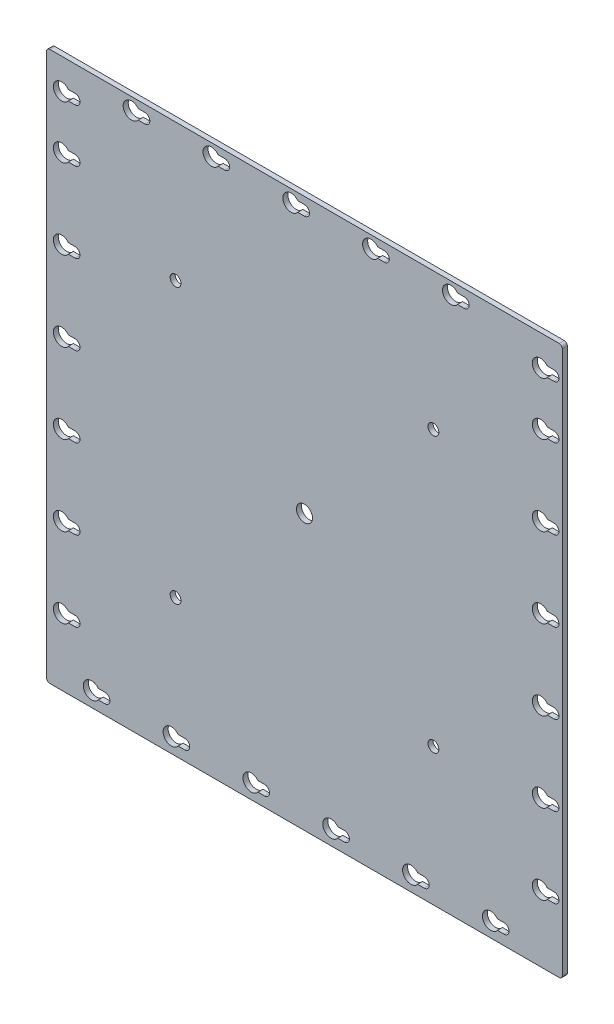
from build123d import *

# Parameters (mm, degrees)
SKETCH1_W               = 164.1
SKETCH1_H               = 174.745
SKETCH1_R               = 2.5527
BOSS_EXTRUDE1_DEPTH     = 1.6
FILLET1_R               = 1
CUT_EXTRUDE1_DEPTH      = 241.065688979
CUT_EXTRUDE1_DEPTH_BACK = 241.065688979
SKETCH2_R               = 1.725


with BuildPart() as part:
    # Sketch1 → Boss-Extrude1 (new body)
    with BuildSketch(Plane.XY):
        with Locations((82.55, -87.3725)):
            Rectangle(SKETCH1_W, SKETCH1_H)
        with Locations((82.55, -87.3725)):
            Circle(SKETCH1_R, mode=Mode.SUBTRACT)
        with BuildLine():
            Line((82.55, -5.4375), (80.434372699, -5.4375))
            ThreePointArc((80.434372699, -5.4375), (75.6625, -3.85), (80.434372699, -2.2625))
            Line((80.434372699, -2.2625), (82.55, -2.2625))
            ThreePointArc((82.55, -2.2625), (84.1375, -3.85), (82.55, -5.4375))
        make_face(mode=Mode.SUBTRACT)
        with BuildLine():
            Line((16.934372699, -168.395), (19.05, -168.395))
            ThreePointArc((19.05, -168.395), (20.6375, -169.9825), (19.05, -171.57))
            Line((19.05, -171.57), (16.934372699, -171.57))
            ThreePointArc((16.934372699, -171.57), (12.1625, -169.9825), (16.934372699, -168.395))
        make_face(mode=Mode.SUBTRACT)
        with BuildLine():
            Line((7.409372699, -151.9325), (9.525, -151.9325))
            ThreePointArc((9.525, -151.9325), (11.1125, -153.52), (9.525, -155.1075))
            Line((9.525, -155.1075), (7.409372699, -155.1075))
            ThreePointArc((7.409372699, -155.1075), (2.6375, -153.52), (7.409372699, -151.9325))
        make_face(mode=Mode.SUBTRACT)
        with BuildLine():
            Line((42.334372699, -168.395), (44.45, -168.395))
            ThreePointArc((44.45, -168.395), (46.0375, -169.9825), (44.45, -171.57))
            Line((44.45, -171.57), (42.334372699, -171.57))
            ThreePointArc((42.334372699, -171.57), (37.5625, -169.9825), (42.334372699, -168.395))
        make_face(mode=Mode.SUBTRACT)
        with BuildLine():
            Line((67.734372699, -168.395), (69.85, -168.395))
            ThreePointArc((69.85, -168.395), (71.4375, -169.9825), (69.85, -171.57))
            Line((69.85, -171.57), (67.734372699, -171.57))
            ThreePointArc((67.734372699, -171.57), (62.9625, -169.9825), (67.734372699, -168.395))
        make_face(mode=Mode.SUBTRACT)
        with BuildLine():
            Line((7.409372699, -126.5325), (9.525, -126.5325))
            ThreePointArc((9.525, -126.5325), (11.1125, -128.12), (9.525, -129.7075))
            Line((9.525, -129.7075), (7.409372699, -129.7075))
            ThreePointArc((7.409372699, -129.7075), (2.6375, -128.12), (7.409372699, -126.5325))
        make_face(mode=Mode.SUBTRACT)
        with BuildLine():
            Line((7.409372699, -101.1325), (9.525, -101.1325))
            ThreePointArc((9.525, -101.1325), (11.1125, -102.72), (9.525, -104.3075))
            Line((9.525, -104.3075), (7.409372699, -104.3075))
            ThreePointArc((7.409372699, -104.3075), (2.6375, -102.72), (7.409372699, -101.1325))
        make_face(mode=Mode.SUBTRACT)
        with BuildLine():
            Line((7.409372699, -75.7325), (9.525, -75.7325))
            ThreePointArc((9.525, -75.7325), (11.1125, -77.32), (9.525, -78.9075))
            Line((9.525, -78.9075), (7.409372699, -78.9075))
            ThreePointArc((7.409372699, -78.9075), (2.6375, -77.32), (7.409372699, -75.7325))
        make_face(mode=Mode.SUBTRACT)
        with BuildLine():
            Line((7.409372699, -50.3325), (9.525, -50.3325))
            ThreePointArc((9.525, -50.3325), (11.1125, -51.92), (9.525, -53.5075))
            Line((9.525, -53.5075), (7.409372699, -53.5075))
            ThreePointArc((7.409372699, -53.5075), (2.6375, -51.92), (7.409372699, -50.3325))
        make_face(mode=Mode.SUBTRACT)
        with BuildLine():
            Line((7.409372699, -24.9325), (9.525, -24.9325))
            ThreePointArc((9.525, -24.9325), (11.1125, -26.52), (9.525, -28.1075))
            Line((9.525, -28.1075), (7.409372699, -28.1075))
            ThreePointArc((7.409372699, -28.1075), (2.6375, -26.52), (7.409372699, -24.9325))
        make_face(mode=Mode.SUBTRACT)
        with BuildLine():
            Line((7.409372699, -8.1), (9.525, -8.1))
            ThreePointArc((9.525, -8.1), (11.1125, -9.6875), (9.525, -11.275))
            Line((9.525, -11.275), (7.409372699, -11.275))
            ThreePointArc((7.409372699, -11.275), (2.6375, -9.6875), (7.409372699, -8.1))
        make_face(mode=Mode.SUBTRACT)
        with BuildLine():
            Line((29.634372699, -2.2625), (31.75, -2.2625))
            ThreePointArc((31.75, -2.2625), (33.3375, -3.85), (31.75, -5.4375))
            Line((31.75, -5.4375), (29.634372699, -5.4375))
            ThreePointArc((29.634372699, -5.4375), (24.8625, -3.85), (29.634372699, -2.2625))
        make_face(mode=Mode.SUBTRACT)
        with BuildLine():
            Line((55.034372699, -2.2625), (57.15, -2.2625))
            ThreePointArc((57.15, -2.2625), (58.7375, -3.85), (57.15, -5.4375))
            Line((57.15, -5.4375), (55.034372699, -5.4375))
            ThreePointArc((55.034372699, -5.4375), (50.2625, -3.85), (55.034372699, -2.2625))
        make_face(mode=Mode.SUBTRACT)
        with BuildLine():
            ThreePointArc((161.925, -8.1), (163.5125, -9.6875), (161.925, -11.275))
            Line((161.925, -11.275), (159.809372699, -11.275))
            ThreePointArc((159.809372699, -11.275), (155.0375, -9.6875), (159.809372699, -8.1))
            Line((159.809372699, -8.1), (161.925, -8.1))
        make_face(mode=Mode.SUBTRACT)
        with BuildLine():
            Line((93.134372699, -168.395), (95.25, -168.395))
            ThreePointArc((95.25, -168.395), (96.8375, -169.9825), (95.25, -171.57))
            Line((95.25, -171.57), (93.134372699, -171.57))
            ThreePointArc((93.134372699, -171.57), (88.3625, -169.9825), (93.134372699, -168.395))
        make_face(mode=Mode.SUBTRACT)
        with BuildLine():
            Line((118.534372699, -168.395), (120.65, -168.395))
            ThreePointArc((120.65, -168.395), (122.2375, -169.9825), (120.65, -171.57))
            Line((120.65, -171.57), (118.534372699, -171.57))
            ThreePointArc((118.534372699, -171.57), (113.7625, -169.9825), (118.534372699, -168.395))
        make_face(mode=Mode.SUBTRACT)
        with BuildLine():
            Line((143.934372699, -168.395), (146.05, -168.395))
            ThreePointArc((146.05, -168.395), (147.6375, -169.9825), (146.05, -171.57))
            Line((146.05, -171.57), (143.934372699, -171.57))
            ThreePointArc((143.934372699, -171.57), (139.1625, -169.9825), (143.934372699, -168.395))
        make_face(mode=Mode.SUBTRACT)
        with BuildLine():
            Line((159.809372699, -151.9325), (161.925, -151.9325))
            ThreePointArc((161.925, -151.9325), (163.5125, -153.52), (161.925, -155.1075))
            Line((161.925, -155.1075), (159.809372699, -155.1075))
            ThreePointArc((159.809372699, -155.1075), (155.0375, -153.52), (159.809372699, -151.9325))
        make_face(mode=Mode.SUBTRACT)
        with BuildLine():
            Line((159.809372699, -126.5325), (161.925, -126.5325))
            ThreePointArc((161.925, -126.5325), (163.5125, -128.12), (161.925, -129.7075))
            Line((161.925, -129.7075), (159.809372699, -129.7075))
            ThreePointArc((159.809372699, -129.7075), (155.0375, -128.12), (159.809372699, -126.5325))
        make_face(mode=Mode.SUBTRACT)
        with BuildLine():
            Line((159.809372699, -101.1325), (161.925, -101.1325))
            ThreePointArc((161.925, -101.1325), (163.5125, -102.72), (161.925, -104.3075))
            Line((161.925, -104.3075), (159.809372699, -104.3075))
            ThreePointArc((159.809372699, -104.3075), (155.0375, -102.72), (159.809372699, -101.1325))
        make_face(mode=Mode.SUBTRACT)
        with BuildLine():
            Line((159.809372699, -75.7325), (161.925, -75.7325))
            ThreePointArc((161.925, -75.7325), (163.5125, -77.32), (161.925, -78.9075))
            Line((161.925, -78.9075), (159.809372699, -78.9075))
            ThreePointArc((159.809372699, -78.9075), (155.0375, -77.32), (159.809372699, -75.7325))
        make_face(mode=Mode.SUBTRACT)
        with BuildLine():
            Line((159.809372699, -50.3325), (161.925, -50.3325))
            ThreePointArc((161.925, -50.3325), (163.5125, -51.92), (161.925, -53.5075))
            Line((161.925, -53.5075), (159.809372699, -53.5075))
            ThreePointArc((159.809372699, -53.5075), (155.0375, -51.92), (159.809372699, -50.3325))
        make_face(mode=Mode.SUBTRACT)
        with BuildLine():
            Line((105.834372699, -2.2625), (107.95, -2.2625))
            ThreePointArc((107.95, -2.2625), (109.5375, -3.85), (107.95, -5.4375))
            Line((107.95, -5.4375), (105.834372699, -5.4375))
            ThreePointArc((105.834372699, -5.4375), (101.0625, -3.85), (105.834372699, -2.2625))
        make_face(mode=Mode.SUBTRACT)
        with BuildLine():
            Line((159.809372699, -24.9325), (161.925, -24.9325))
            ThreePointArc((161.925, -24.9325), (163.5125, -26.52), (161.925, -28.1075))
            Line((161.925, -28.1075), (159.809372699, -28.1075))
            ThreePointArc((159.809372699, -28.1075), (155.0375, -26.52), (159.809372699, -24.9325))
        make_face(mode=Mode.SUBTRACT)
        with BuildLine():
            Line((131.234372699, -2.2625), (133.35, -2.2625))
            ThreePointArc((133.35, -2.2625), (134.9375, -3.85), (133.35, -5.4375))
            Line((133.35, -5.4375), (131.234372699, -5.4375))
            ThreePointArc((131.234372699, -5.4375), (126.4625, -3.85), (131.234372699, -2.2625))
        make_face(mode=Mode.SUBTRACT)
    extrude(amount=BOSS_EXTRUDE1_DEPTH)

    # Fillet1
    fillet1_edges = [part.edges().sort_by_distance(p)[0] for p in [
        (0.5, -174.745, 0.8),
        (0.5, 0, 0.8),
        (164.6, 0, 0.8),
        (164.6, -174.745, 0.8),
    ]]
    fillet(fillet1_edges, radius=FILLET1_R)

    # Sketch2 → Cut-Extrude1 (cut, two sides: drawn at the far end of the back side and taken through both)
    with BuildSketch(Plane.XY.offset(1.6).offset(-CUT_EXTRUDE1_DEPTH_BACK)):
        with Locations((41.525, -43.68625)):
            Circle(SKETCH2_R)
        with Locations((123.575, -43.68625)):
            Circle(SKETCH2_R)
        with Locations((123.575, -131.05875)):
            Circle(SKETCH2_R)
        with Locations((41.525, -131.05875)):
            Circle(SKETCH2_R)
    extrude(amount=CUT_EXTRUDE1_DEPTH + CUT_EXTRUDE1_DEPTH_BACK, mode=Mode.SUBTRACT)


solid = part.part
